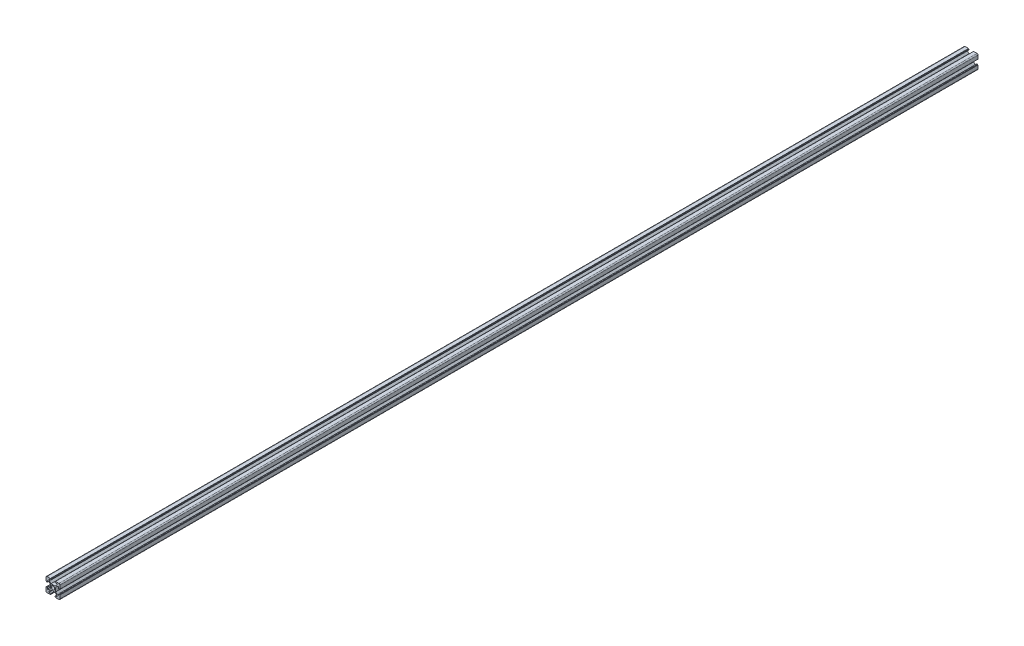
from build123d import *

# Parameters (mm, degrees)
SKETCH1_R           = 2.5
BOSS_EXTRUDE1_DEPTH = 1313


with BuildPart() as part:
    # Sketch1 → Boss-Extrude1 (new body)
    with BuildSketch(Plane.XY):
        with BuildLine():
            Line((2.839339828, 3.9), (5.5, 6.560660172))
            Line((5.5, 6.560660172), (5.5, 8.2))
            Line((5.5, 8.2), (3.1, 8.2))
            Line((3.1, 8.2), (3.1, 9.5))
            Line((3.1, 9.5), (3.6, 9.5))
            Line((3.6, 9.5), (3.6, 10))
            Line((3.6, 10), (8.5, 10))
            ThreePointArc((8.5, 10), (9.560660172, 9.560660172), (10, 8.5))
            Line((10, 8.5), (10, 3.6))
            Line((10, 3.6), (9.5, 3.6))
            Line((9.5, 3.6), (9.5, 3.1))
            Line((9.5, 3.1), (8.2, 3.1))
            Line((8.2, 3.1), (8.2, 5.5))
            Line((8.2, 5.5), (6.560660172, 5.5))
            Line((6.560660172, 5.5), (3.9, 2.839339828))
            Line((3.9, 2.839339828), (3.9, -2.839339828))
            Line((3.9, -2.839339828), (6.560660172, -5.5))
            Line((6.560660172, -5.5), (8.2, -5.5))
            Line((8.2, -5.5), (8.2, -3.1))
            Line((8.2, -3.1), (9.5, -3.1))
            Line((9.5, -3.1), (9.5, -3.6))
            Line((9.5, -3.6), (10, -3.6))
            Line((10, -3.6), (10, -8.5))
            ThreePointArc((10, -8.5), (9.560660172, -9.560660172), (8.5, -10))
            Line((8.5, -10), (3.6, -10))
            Line((3.6, -10), (3.6, -9.5))
            Line((3.6, -9.5), (3.1, -9.5))
            Line((3.1, -9.5), (3.1, -8.2))
            Line((3.1, -8.2), (5.5, -8.2))
            Line((5.5, -8.2), (5.5, -6.560660172))
            Line((5.5, -6.560660172), (2.839339828, -3.9))
            Line((2.839339828, -3.9), (-2.839339828, -3.9))
            Line((-2.839339828, -3.9), (-5.5, -6.560660172))
            Line((-5.5, -6.560660172), (-5.5, -8.2))
            Line((-5.5, -8.2), (-3.1, -8.2))
            Line((-3.1, -8.2), (-3.1, -9.5))
            Line((-3.1, -9.5), (-3.6, -9.5))
            Line((-3.6, -9.5), (-3.6, -10))
            Line((-3.6, -10), (-8.5, -10))
            ThreePointArc((-8.5, -10), (-9.560660172, -9.560660172), (-10, -8.5))
            Line((-10, -8.5), (-10, -3.6))
            Line((-10, -3.6), (-9.5, -3.6))
            Line((-9.5, -3.6), (-9.5, -3.1))
            Line((-9.5, -3.1), (-8.2, -3.1))
            Line((-8.2, -3.1), (-8.2, -5.5))
            Line((-8.2, -5.5), (-6.560660172, -5.5))
            Line((-6.560660172, -5.5), (-3.9, -2.839339828))
            Line((-3.9, -2.839339828), (-3.9, 2.839339828))
            Line((-3.9, 2.839339828), (-6.560660172, 5.5))
            Line((-6.560660172, 5.5), (-8.2, 5.5))
            Line((-8.2, 5.5), (-8.2, 3.1))
            Line((-8.2, 3.1), (-9.5, 3.1))
            Line((-9.5, 3.1), (-9.5, 3.6))
            Line((-9.5, 3.6), (-10, 3.6))
            Line((-10, 3.6), (-10, 8.5))
            ThreePointArc((-10, 8.5), (-9.560660172, 9.560660172), (-8.5, 10))
            Line((-8.5, 10), (-3.6, 10))
            Line((-3.6, 10), (-3.6, 9.5))
            Line((-3.6, 9.5), (-3.1, 9.5))
            Line((-3.1, 9.5), (-3.1, 8.2))
            Line((-3.1, 8.2), (-5.5, 8.2))
            Line((-5.5, 8.2), (-5.5, 6.560660172))
            Line((-5.5, 6.560660172), (-2.839339828, 3.9))
            Line((-2.839339828, 3.9), (2.839339828, 3.9))
        make_face()
        with Locations((0, 0.235847297)):
            Circle(SKETCH1_R, mode=Mode.SUBTRACT)
    extrude(amount=BOSS_EXTRUDE1_DEPTH)


solid = part.part
